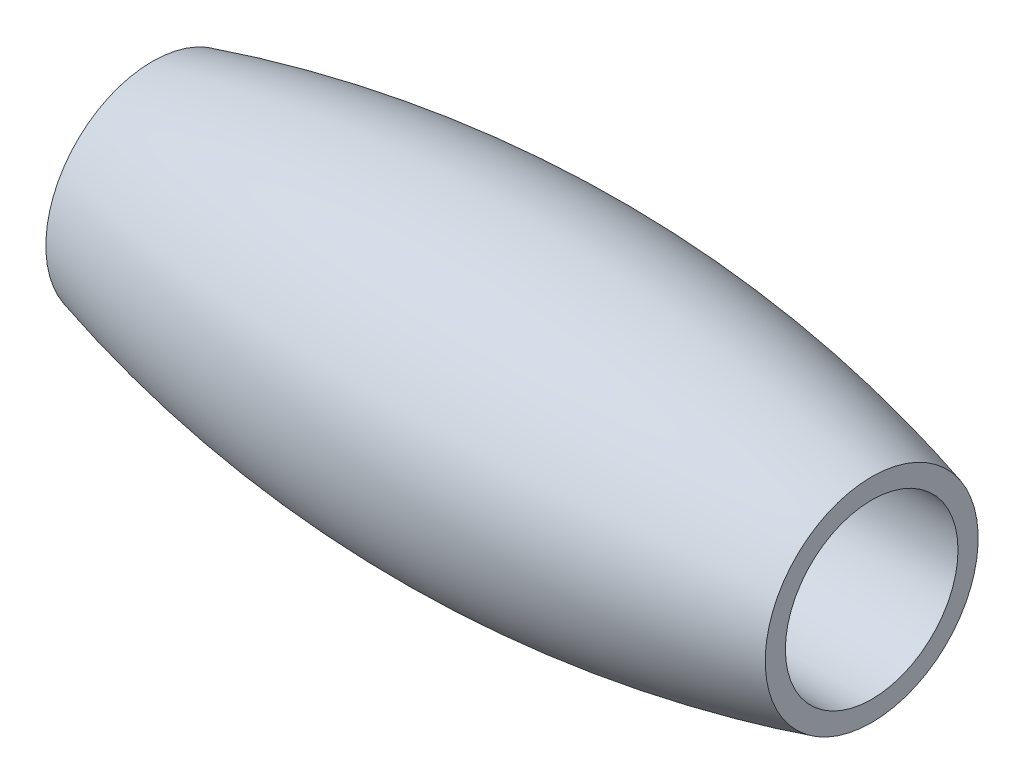
from build123d import *


with BuildPart() as part:
    # Sketch1 → Revolve1 (revolve)
    with BuildSketch(Plane(origin=(0, 0, 0), x_dir=(-1, 0, 0), z_dir=(0, 0, -1)), mode=Mode.PRIVATE) as revolve1_sk:
        with BuildLine():
            Line((-18.75, 5.55), (-18.75, 4.5))
            Line((-18.75, 4.5), (18.75, 4.5))
            Line((18.75, 4.5), (18.75, 5.55))
            ThreePointArc((18.75, 5.55), (0, 8.1), (-18.75, 5.55))
        make_face()
    revolve(revolve1_sk.sketch.rotate(Axis((18.75, 0, 0), (-1, 0, 0)), 180), axis=Axis((18.75, 0, 0), (-1, 0, 0)))


solid = part.part
